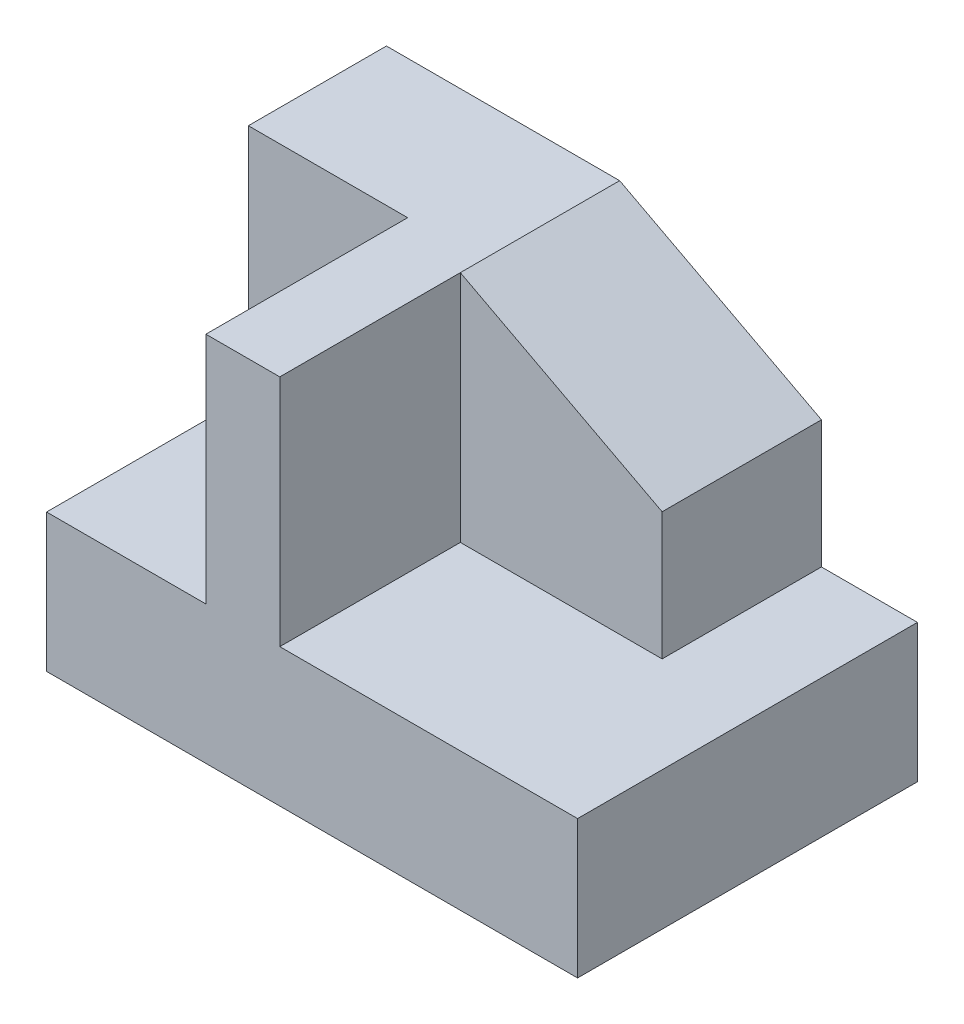
from build123d import *

# Parameters (mm, degrees)
SKETCH1_W           = 50
SKETCH1_H           = 32
BOSS_EXTRUDE1_DEPTH = 13
SKETCH2_W           = 15
SKETCH2_H           = 22
BOSS_EXTRUDE2_DEPTH = 13
SKETCH3_W           = 6.961388266
SKETCH3_H           = 22
BOSS_EXTRUDE3_DEPTH = 32
SKETCH4_W           = 19
SKETCH4_H           = 12
BOSS_EXTRUDE4_DEPTH = 15
BOSS_EXTRUDE5_DEPTH = 15


with BuildPart() as part:
    # Sketch1 → Boss-Extrude1 (new body)
    with BuildSketch(Plane(origin=(0, 0, 0), x_dir=(1, 0, 0), z_dir=(0, 1, 0))):
        Rectangle(SKETCH1_W, SKETCH1_H)
    extrude(amount=BOSS_EXTRUDE1_DEPTH)

    # Sketch2 → Boss-Extrude2 (add)
    with BuildSketch(Plane(origin=(0, 0, -16), x_dir=(-1, 0, 0), z_dir=(0, 0, -1))):
        with Locations((17.5, 24)):
            Rectangle(SKETCH2_W, SKETCH2_H)
    extrude(amount=-BOSS_EXTRUDE2_DEPTH)

    # Sketch3 → Boss-Extrude3 (add)
    with BuildSketch(Plane.XY.offset(16)):
        with Locations((-6.519305867, 24)):
            Rectangle(SKETCH3_W, SKETCH3_H)
    extrude(amount=-BOSS_EXTRUDE3_DEPTH)

    # Sketch4 → Boss-Extrude4 (add)
    with BuildSketch(Plane(origin=(0, 0, -16), x_dir=(-1, 0, 0), z_dir=(0, 0, -1))):
        with Locations((-6.461388266, 19)):
            Rectangle(SKETCH4_W, SKETCH4_H)
    extrude(amount=-BOSS_EXTRUDE4_DEPTH)

    # Sketch5 → Boss-Extrude5 (add)
    with BuildSketch(Plane(origin=(0, 0, -16), x_dir=(-1, 0, 0), z_dir=(0, 0, -1))):
        Polygon((-15.961388266, 25), (3.038611734, 35), (3.038611734, 25), align=None)
    extrude(amount=-BOSS_EXTRUDE5_DEPTH)


solid = part.part
